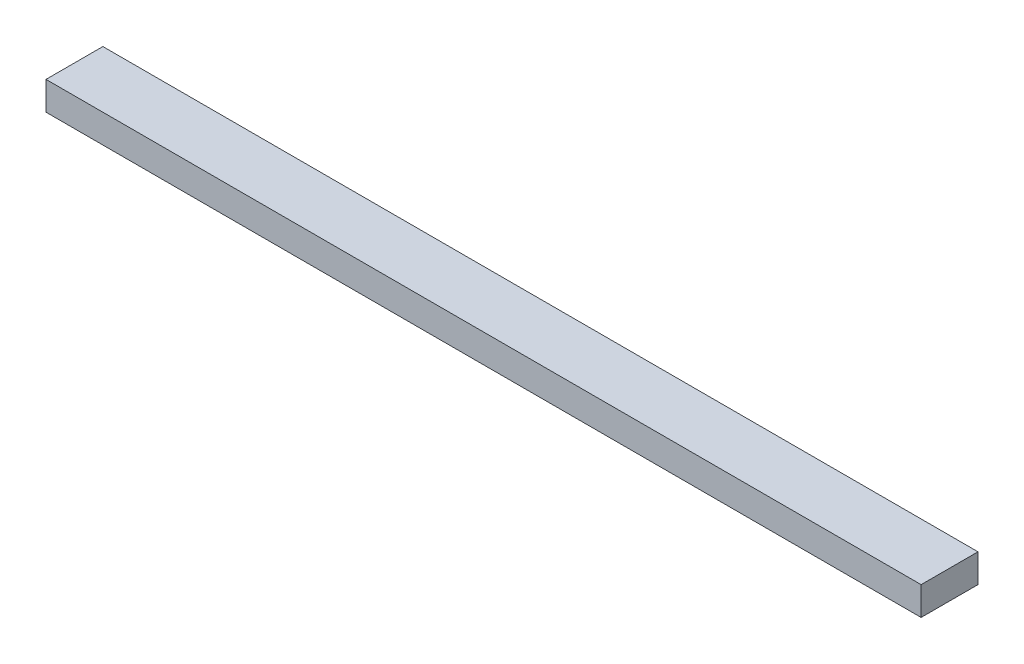
from build123d import *

# Parameters (mm, degrees)
SKETCH1_W           = 97.7
SKETCH1_H           = 6.35
BOSS_EXTRUDE1_DEPTH = 3.175


with BuildPart() as part:
    # Sketch1 → Boss-Extrude1 (new body)
    with BuildSketch(Plane(origin=(0, 0, 0), x_dir=(1, 0, 0), z_dir=(0, 1, 0))):
        with Locations((48.85, 3.175)):
            Rectangle(SKETCH1_W, SKETCH1_H)
    extrude(amount=BOSS_EXTRUDE1_DEPTH)


solid = part.part
